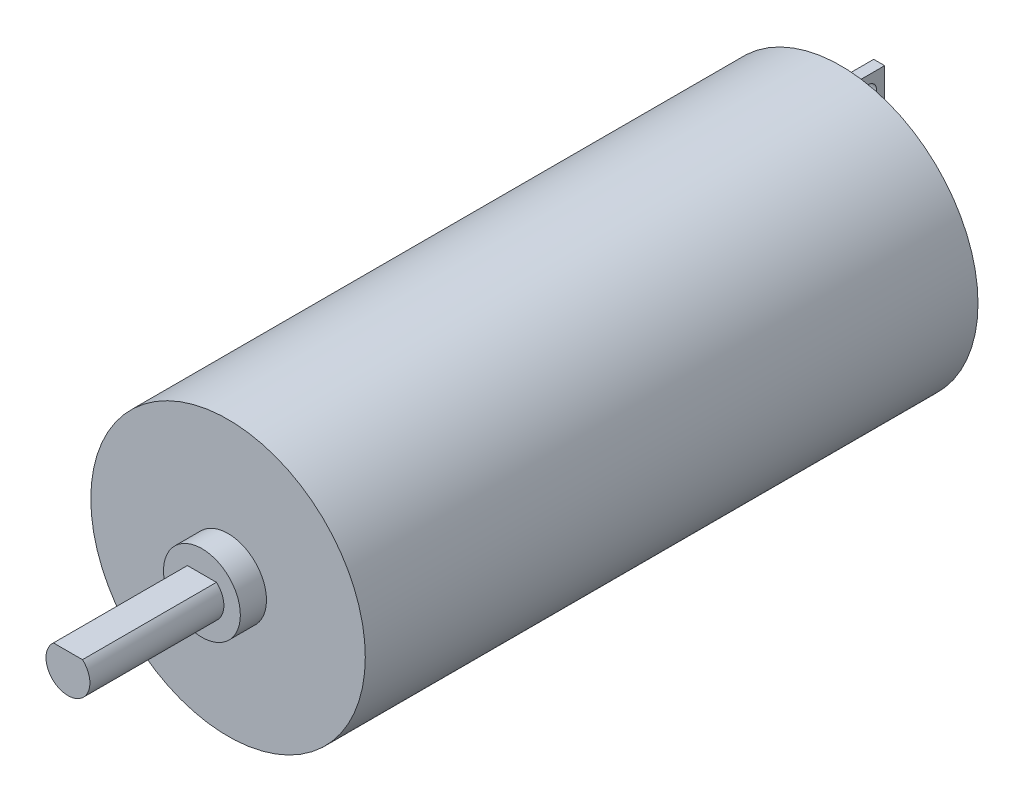
from build123d import *

# Parameters (mm, degrees)
SKETCH1_R               = 12.5
BOSS_EXTRUDE1_DEPTH     = 55.8
BOSS_EXTRUDE2_START     = 55.8
SKETCH2_R               = 3.5
BOSS_EXTRUDE2_DEPTH     = 2.38
BOSS_EXTRUDE3_START     = 58.18
SKETCH3_R               = 2
BOSS_EXTRUDE3_DEPTH     = 12.2
SKETCH5_W               = 2.645751312
SKETCH5_H               = 1.197132969
CUT_EXTRUDE1_DEPTH      = 12.2
SKETCH6_W               = 1
SKETCH6_H               = 3
BOSS_EXTRUDE4_DEPTH     = 3.5
CUT_EXTRUDE2_DEPTH      = 73.566138109
CUT_EXTRUDE2_DEPTH_BACK = 73.566138109
SKETCH7_R               = 0.75


with BuildPart() as part:
    # Sketch1 → Boss-Extrude1 (new body)
    with BuildSketch(Plane.XY):
        Circle(SKETCH1_R)
    extrude(amount=BOSS_EXTRUDE1_DEPTH)

    # Sketch2 → Boss-Extrude2 (add)
    with BuildSketch(Plane.XY.offset(BOSS_EXTRUDE2_START)):
        Circle(SKETCH2_R)
    extrude(amount=BOSS_EXTRUDE2_DEPTH)

    # Sketch3 → Boss-Extrude3 (add)
    with BuildSketch(Plane.XY.offset(BOSS_EXTRUDE3_START)):
        Circle(SKETCH3_R)
    extrude(amount=BOSS_EXTRUDE3_DEPTH)

    # Sketch5 → Cut-Extrude1 (cut)
    with BuildSketch(Plane.XY.offset(58.18)):
        with Locations((0, 2.098566485)):
            Rectangle(SKETCH5_W, SKETCH5_H)
    extrude(amount=CUT_EXTRUDE1_DEPTH, mode=Mode.SUBTRACT)

    # Sketch6 → Boss-Extrude4 (add)
    with BuildSketch(Plane.XY):
        with Locations((0, 9.5)):
            Rectangle(SKETCH6_W, SKETCH6_H)
        with Locations((0, -9.5)):
            Rectangle(SKETCH6_W, SKETCH6_H)
    extrude(amount=-BOSS_EXTRUDE4_DEPTH)

    # Sketch7 → Cut-Extrude2 (cut, two sides: drawn at the far end of the back side and taken through both)
    with BuildSketch(Plane(origin=(0, 0, 0), x_dir=(0, 0, -1), z_dir=(1, 0, 0)).offset(-CUT_EXTRUDE2_DEPTH_BACK)):
        with Locations(Location((2, 9.5, 0), (0, 0, 90))):
            Circle(SKETCH7_R)
        with Locations(Location((2, -9.5, 0), (0, 0, 90))):
            Circle(SKETCH7_R)
    extrude(amount=CUT_EXTRUDE2_DEPTH + CUT_EXTRUDE2_DEPTH_BACK, mode=Mode.SUBTRACT)


solid = part.part
